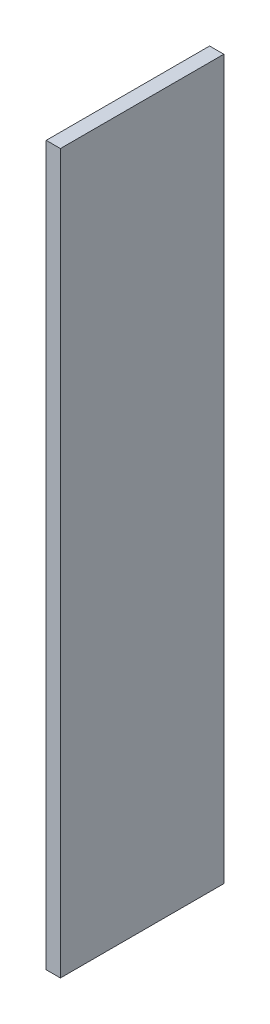
from build123d import *

# Parameters (mm, degrees)
SKETCH1_W           = 101.6
SKETCH1_H           = 1168.4
BOSS_EXTRUDE1_DEPTH = 5137.15


with BuildPart() as part:
    # Sketch1 → Boss-Extrude1 (new body)
    with BuildSketch(Plane(origin=(0, 0, 0), x_dir=(1, 0, 0), z_dir=(0, 1, 0))):
        Rectangle(SKETCH1_W, SKETCH1_H)
    extrude(amount=BOSS_EXTRUDE1_DEPTH)


solid = part.part
